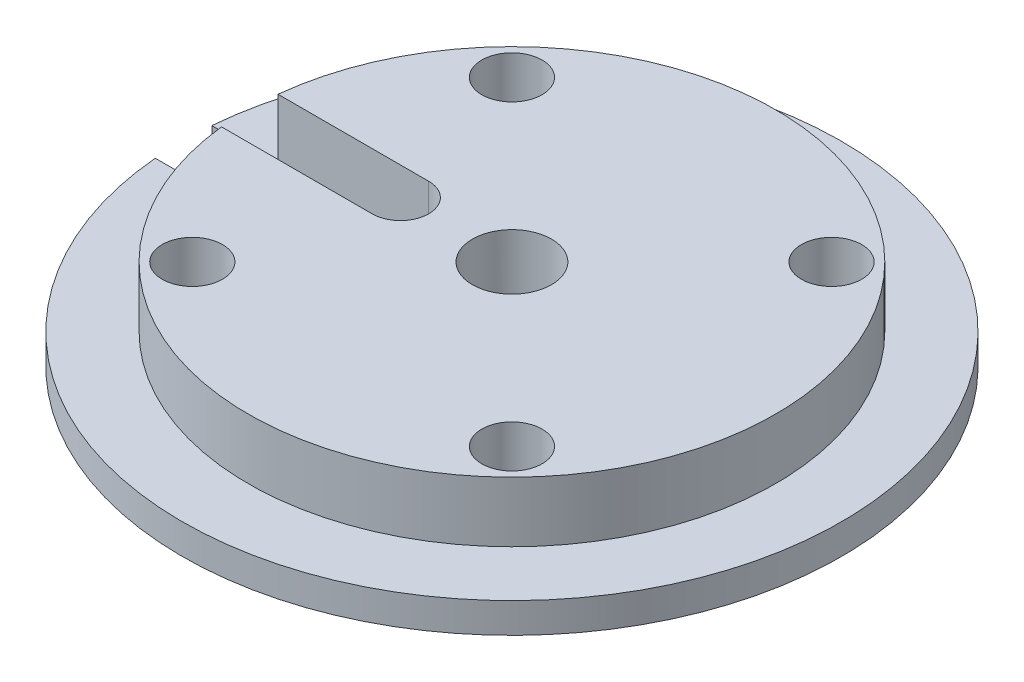
from build123d import *
from build123d.topology import SkipClean

# Parameters (mm, degrees)
SKETCH_1_R          = 14
SKETCH_1_R_2        = 2.1
EXTRUDE_1_DEPTH     = 3.2
CUT_EXTRUDE_1_DEPTH = 10
EXTRUDE_START       = 1.6
SKETCH_3_R          = 2.1
EXTRUDE_2_DEPTH     = 1.6
SKETCH_4_R          = 1.6
CUT_EXTRUDE_2_DEPTH = 26.209918683


with BuildPart() as part:
    # ｽｹｯﾁ1 → ﾎﾞｽ - 押し出し1 (new body)
    with BuildSketch(Plane(origin=(0, 0, 0), x_dir=(1, 0, 0), z_dir=(0, 1, 0))):
        with Locations(Location((0, 0, 0), (0, 0, 270))):
            Circle(SKETCH_1_R)
        with Locations(Location((0, 0, 0), (0, 0, 270))):
            Circle(SKETCH_1_R_2, mode=Mode.SUBTRACT)
    extrude(amount=EXTRUDE_1_DEPTH)

    # ｽｹｯﾁ2 → ｶｯﾄ - 押し出し1 (cut)
    with BuildSketch(Plane(origin=(0, 3.2, 0), x_dir=(1, 0, 0), z_dir=(0, 1, 0))):
        with BuildLine():
            Line((-13.919410907, 1.5), (-5.919410907, 1.5))
            ThreePointArc((-5.919410907, 1.5), (-4.419410907, 0), (-5.919410907, -1.5))
            Line((-5.919410907, -1.5), (-13.919410907, -1.5))
            ThreePointArc((-13.919410907, -1.5), (-15.419410907, 0), (-13.919410907, 1.5))
        make_face()
    extrude(amount=-CUT_EXTRUDE_1_DEPTH, mode=Mode.SUBTRACT)

    # ｽｹｯﾁ3 → ﾎﾞｽ - 押し出し2 (add)
    with SkipClean():  # the faces are left unmerged after this step: merging them gives an invalid solid
        with BuildSketch(Plane.XZ.offset(EXTRUDE_START)):
            with BuildLine():
                Line((-17.435595774, -1.5), (-13.919410907, -1.5))
                ThreePointArc((-13.919410907, -1.5), (-12.419410907, 0), (-13.919410907, 1.5))
                Line((-13.919410907, 1.5), (-17.435595774, 1.5))
                ThreePointArc((-17.435595774, 1.5), (17.5, 0), (-17.435595774, -1.5))
            make_face()
            with Locations(Location((0, 0, 0), (0, 0, 270))):
                Circle(SKETCH_3_R, mode=Mode.SUBTRACT)
            with BuildLine():
                Line((-5.919410907, -0.8), (-7.519410907, -0.8))
                ThreePointArc((-7.519410907, -0.8), (-8.319410907, 0), (-7.519410907, 0.8))
                Line((-7.519410907, 0.8), (-5.919410907, 0.8))
                ThreePointArc((-5.919410907, 0.8), (-5.119410907, 0), (-5.919410907, -0.8))
            make_face(mode=Mode.SUBTRACT)
        extrude(amount=-EXTRUDE_2_DEPTH)

    # ｽｹｯﾁ4 → ｶｯﾄ - 押し出し2 (cut, through all)
    with SkipClean():  # the faces are left unmerged after this step: merging them gives an invalid solid
        with BuildSketch(Plane.XZ.offset(1.6)):
            with Locations(Location((-8.485281374, 8.485281374, 0), (0, 0, 270))):
                Circle(SKETCH_4_R)
            with Locations(Location((8.485281374, -8.485281374, 0), (0, 0, 90))):
                Circle(SKETCH_4_R)
            with Locations(Location((8.485281374, 8.485281374, 0), (0, 0, 90))):
                Circle(SKETCH_4_R)
            with Locations(Location((-8.485281374, -8.485281374, 0), (0, 0, 90))):
                Circle(SKETCH_4_R)
        extrude(amount=-CUT_EXTRUDE_2_DEPTH, mode=Mode.SUBTRACT)


solid = part.part
